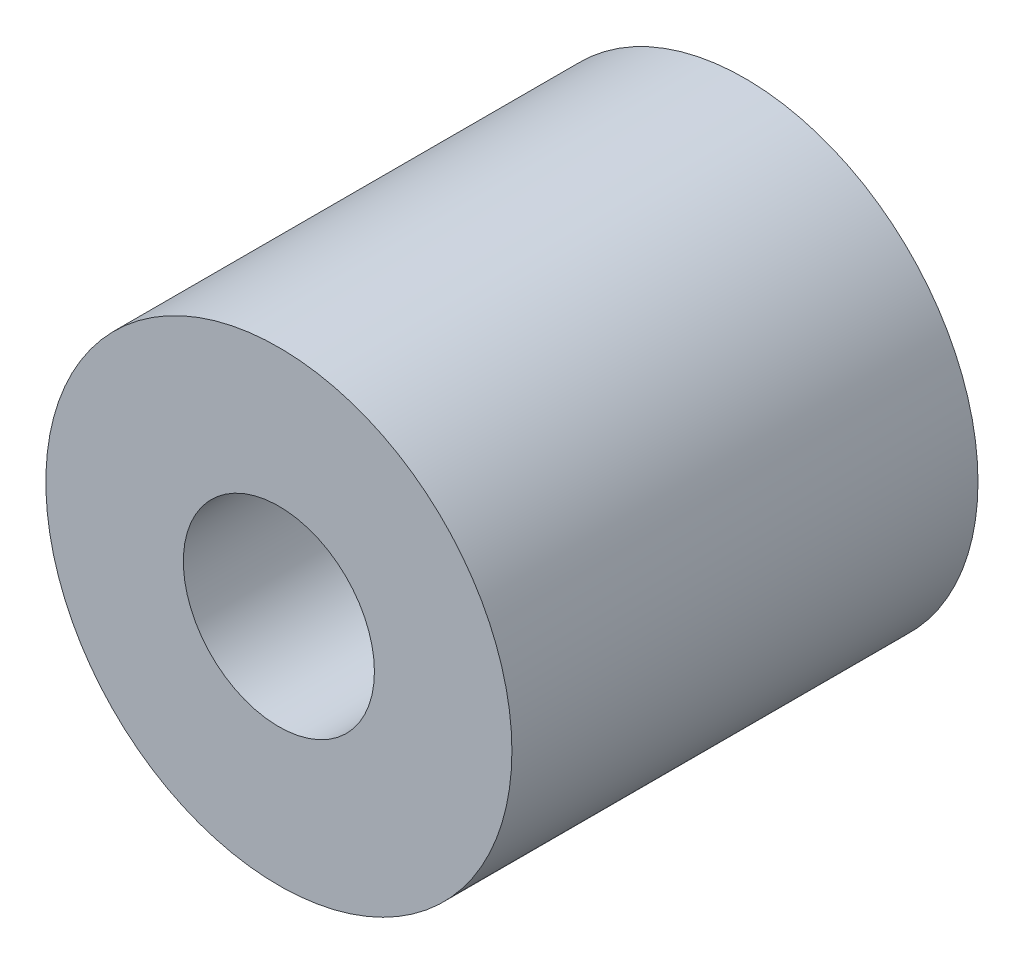
from build123d import *

# Parameters (mm, degrees)
SKETCH1_R           = 6.35
SKETCH1_R_2         = 2.6035
BOSS_EXTRUDE1_DEPTH = 6.35


with BuildPart() as part:
    # Sketch1 → Boss-Extrude1 (new, symmetric)
    with BuildSketch(Plane.XY):
        Circle(SKETCH1_R)
        Circle(SKETCH1_R_2, mode=Mode.SUBTRACT)
    extrude(amount=BOSS_EXTRUDE1_DEPTH, both=True)


solid = part.part
